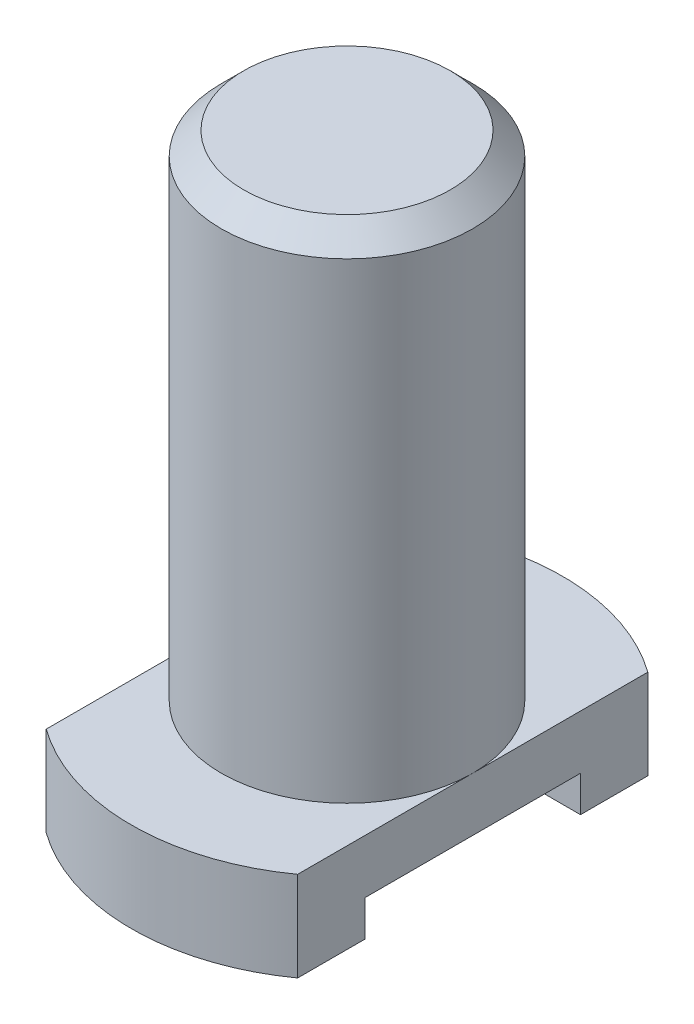
from build123d import *

# Parameters (mm, degrees)
SKETCH1_R           = 1.4
BOSS_EXTRUDE3_DEPTH = 6.5
BOSS_EXTRUDE4_DEPTH = 1
CHAMFER1_SIZE       = 0.25
SKETCH4_W           = 2.4
SKETCH4_H           = 0.8
CUT_EXTRUDE1_DEPTH  = 3.6


with BuildPart() as part:
    # Sketch1 → Boss-Extrude3 (new body)
    with BuildSketch(Plane(origin=(0, 0, 0), x_dir=(1, 0, 0), z_dir=(0, 1, 0))):
        with Locations(Location((0, 0, 0), (0, 0, 90))):
            Circle(SKETCH1_R)
    extrude(amount=BOSS_EXTRUDE3_DEPTH)

    # Sketch3 → Boss-Extrude4 (add)
    with BuildSketch(Plane(origin=(0, 0, 0), x_dir=(1, 0, 0), z_dir=(0, 1, 0))):
        with BuildLine():
            Line((-1.4, 0), (-1.4, -1.949358869))
            ThreePointArc((-1.4, -1.949358869), (0, -2.4), (1.4, -1.949358869))
            Line((1.4, -1.949358869), (1.4, 0))
            ThreePointArc((1.4, 0), (0, -1.4), (-1.4, 0))
        make_face()
        with BuildLine():
            Line((-1.4, 1.949358869), (-1.4, 0))
            ThreePointArc((-1.4, 0), (0, 1.4), (1.4, 0))
            Line((1.4, 0), (1.4, 1.949358869))
            ThreePointArc((1.4, 1.949358869), (0, 2.4), (-1.4, 1.949358869))
        make_face()
    extrude(amount=BOSS_EXTRUDE4_DEPTH)

    # Chamfer1
    chamfer1_edges = [part.edges().sort_by_distance(p)[0] for p in [
        (0, 6.5, 1.4),
    ]]
    chamfer(chamfer1_edges, length=CHAMFER1_SIZE)

    # Sketch4 → Cut-Extrude1 (cut)
    with BuildSketch(Plane(origin=(1.4, 0, 0), x_dir=(0, 0, -1), z_dir=(1, 0, 0))):
        Rectangle(SKETCH4_W, SKETCH4_H)
    extrude(amount=-CUT_EXTRUDE1_DEPTH, mode=Mode.SUBTRACT)


solid = part.part
